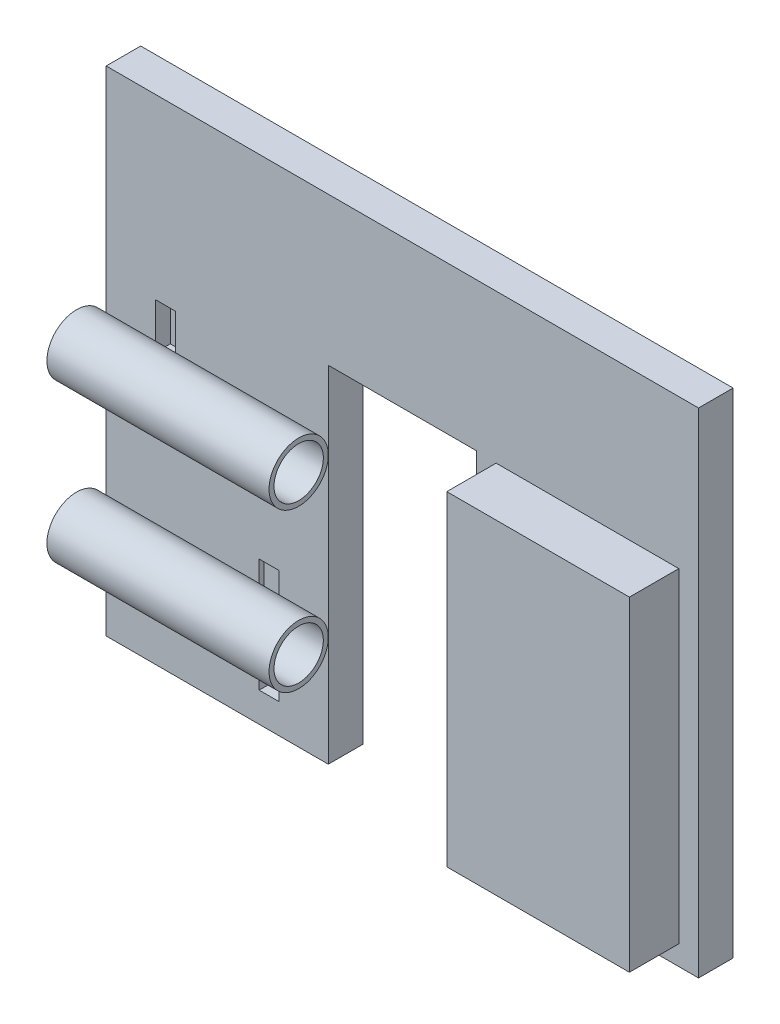
from build123d import *

# Parameters (mm, degrees)
SKETCH2_W            = 120
SKETCH2_H            = 100
BOSS_EXTRUDE1_DEPTH  = 7
SKETCH4_W            = 30
SKETCH4_H            = 70
CUT_EXTRUDE1_DEPTH   = 10
SKETCH5_R            = 6
BOSS_EXTRUDE2_DEPTH  = 45
SKETCH8_R            = 5
CUT_EXTRUDE2_DEPTH   = 45
SKETCH10_W           = 4
SKETCH10_H           = 23
CUT_EXTRUDE4_DEPTH   = 3
SKETCH12_W           = 4
SKETCH12_H           = 2
CUT_EXTRUDE5_DEPTH   = 39
SKETCH13_W           = 4
SKETCH13_H           = 2.002152941
CUT_EXTRUDE6_DEPTH   = 39
SKETCH15_W           = 4
SKETCH15_H           = 0.5
BOSS_EXTRUDE4_DEPTH  = 4
SKETCH17_W           = 2
SKETCH17_H           = 39
BOSS_EXTRUDE7_DEPTH  = 4
SKETCH21_W           = 4
SKETCH21_H           = 0.5
BOSS_EXTRUDE8_DEPTH  = 4
SKETCH23_W           = 2
SKETCH23_H           = 39
BOSS_EXTRUDE11_DEPTH = 4
SKETCH24_R           = 6
BOSS_EXTRUDE13_DEPTH = 45
SKETCH25_R           = 5
CUT_EXTRUDE7_DEPTH   = 45
SKETCH28_W           = 37
SKETCH28_H           = 65.823303479
BOSS_EXTRUDE15_DEPTH = 10
SKETCH30_W           = 7
SKETCH30_H           = 62.823303479
CUT_EXTRUDE8_DEPTH   = 36.5


with BuildPart() as part:
    # Sketch2 → Boss-Extrude1 (new body)
    with BuildSketch(Plane.XY):
        with Locations((60, -50)):
            Rectangle(SKETCH2_W, SKETCH2_H)
    extrude(amount=BOSS_EXTRUDE1_DEPTH)

    # Sketch4 → Cut-Extrude1 (cut)
    with BuildSketch(Plane.XY.offset(7)):
        with Locations((60, -65)):
            Rectangle(SKETCH4_W, SKETCH4_H)
    extrude(amount=-CUT_EXTRUDE1_DEPTH, mode=Mode.SUBTRACT)

    # Sketch10 → Cut-Extrude4 (cut)
    with BuildSketch(Plane.XY.offset(7)):
        with Locations((12, -47.5)):
            Rectangle(SKETCH10_W, SKETCH10_H)
        with Locations((32.99968141, -82.5)):
            Rectangle(SKETCH10_W, SKETCH10_H)
    extrude(amount=-CUT_EXTRUDE4_DEPTH, mode=Mode.SUBTRACT)

    # Sketch12 → Cut-Extrude5 (cut)
    with BuildSketch(Plane(origin=(0, -59, 0), x_dir=(1, 0, 0), z_dir=(0, 1, 0))):
        with Locations((12, -5)):
            Rectangle(SKETCH12_W, SKETCH12_H)
    extrude(amount=-CUT_EXTRUDE5_DEPTH, mode=Mode.SUBTRACT)

    # Sketch13 → Cut-Extrude6 (cut)
    with BuildSketch(Plane.XZ.offset(71)):
        with Locations((32.99968141, 5.001076471)):
            Rectangle(SKETCH13_W, SKETCH13_H)
    extrude(amount=-CUT_EXTRUDE6_DEPTH, mode=Mode.SUBTRACT)



with BuildPart() as body_2:
    # Sketch5 → Boss-Extrude2 (new body)
    with BuildSketch(Plane(origin=(0, 0, 0), x_dir=(0, 0, -1), z_dir=(1, 0, 0))):
        with Locations((-13, -45.753984495)):
            Circle(SKETCH5_R)
    extrude(amount=BOSS_EXTRUDE2_DEPTH)

    # Sketch8 → Cut-Extrude2 (cut)
    with BuildSketch(Plane.ZY):
        with Locations((13, -45.753984495)):
            Circle(SKETCH8_R)
    extrude(amount=-CUT_EXTRUDE2_DEPTH, mode=Mode.SUBTRACT)


with BuildPart() as body_3:
    # Sketch15 → Boss-Extrude4 (new body)
    with BuildSketch(Plane.ZY.offset(-10)):
        with Locations((6, -45.503984495)):
            Rectangle(SKETCH15_W, SKETCH15_H)
    extrude(amount=-BOSS_EXTRUDE4_DEPTH)


with BuildPart() as part_1:
    add(part.part)

    add(body_3.part)  # Boss-Extrude7 merges body 3
    # Sketch17 → Boss-Extrude7 (add)
    with BuildSketch(Plane.ZY.offset(-10)):
        with Locations((5, -65.253984495)):
            Rectangle(SKETCH17_W, SKETCH17_H)
    extrude(amount=-BOSS_EXTRUDE7_DEPTH)

    # Sketch21 → Boss-Extrude8 (add)
    with BuildSketch(Plane(origin=(30.99968141, 0, 0), x_dir=(0, 0, -1), z_dir=(1, 0, 0))):
        with Locations((-8, -78.003984495)):
            Rectangle(SKETCH21_W, SKETCH21_H)
    extrude(amount=BOSS_EXTRUDE8_DEPTH)


with BuildPart() as body_3_2:
    # Sketch23 → Boss-Extrude11 (new body)
    with BuildSketch(Plane(origin=(30.99968141, 0, 0), x_dir=(0, 0, -1), z_dir=(1, 0, 0))):
        with Locations((-5, -58.253984495)):
            Rectangle(SKETCH23_W, SKETCH23_H)
    extrude(amount=BOSS_EXTRUDE11_DEPTH)


with BuildPart() as body_4:
    # Sketch24 → Boss-Extrude13 (new body)
    with BuildSketch(Plane(origin=(0, 0, 0), x_dir=(0, 0, -1), z_dir=(1, 0, 0))):
        with Locations((-13, -77.753984495)):
            Circle(SKETCH24_R)
    extrude(amount=BOSS_EXTRUDE13_DEPTH)


with BuildPart() as cut_extrude7_tool:
    # Sketch25 → Cut-Extrude7 (new body)
    with BuildSketch(Plane(origin=(45, 0, 0), x_dir=(0, 0, -1), z_dir=(1, 0, 0))):
        with Locations((-13, -77.753984495)):
            Circle(SKETCH25_R)
    extrude(amount=-CUT_EXTRUDE7_DEPTH)


with BuildPart() as part_2:
    add(part_1.part)

    # Cut-Extrude7: cut by cut_extrude7_tool
    add(cut_extrude7_tool.part, mode=Mode.SUBTRACT)

    # Sketch28 → Boss-Extrude15 (add)
    with BuildSketch(Plane.XY.offset(7)):
        with Locations((97.5, -63.08834826)):
            Rectangle(SKETCH28_W, SKETCH28_H)
    extrude(amount=BOSS_EXTRUDE15_DEPTH)

    # Sketch30 → Cut-Extrude8 (cut)
    with BuildSketch(Plane.ZY.offset(-79)):
        with Locations((12, -63.08834826)):
            Rectangle(SKETCH30_W, SKETCH30_H)
    extrude(amount=-CUT_EXTRUDE8_DEPTH, mode=Mode.SUBTRACT)


with BuildPart() as body_4_1:
    add(body_4.part)

    # Cut-Extrude7: cut by cut_extrude7_tool
    add(cut_extrude7_tool.part, mode=Mode.SUBTRACT)


solid = Compound([body_2.part, body_3_2.part, part_2.part, body_4_1.part])
